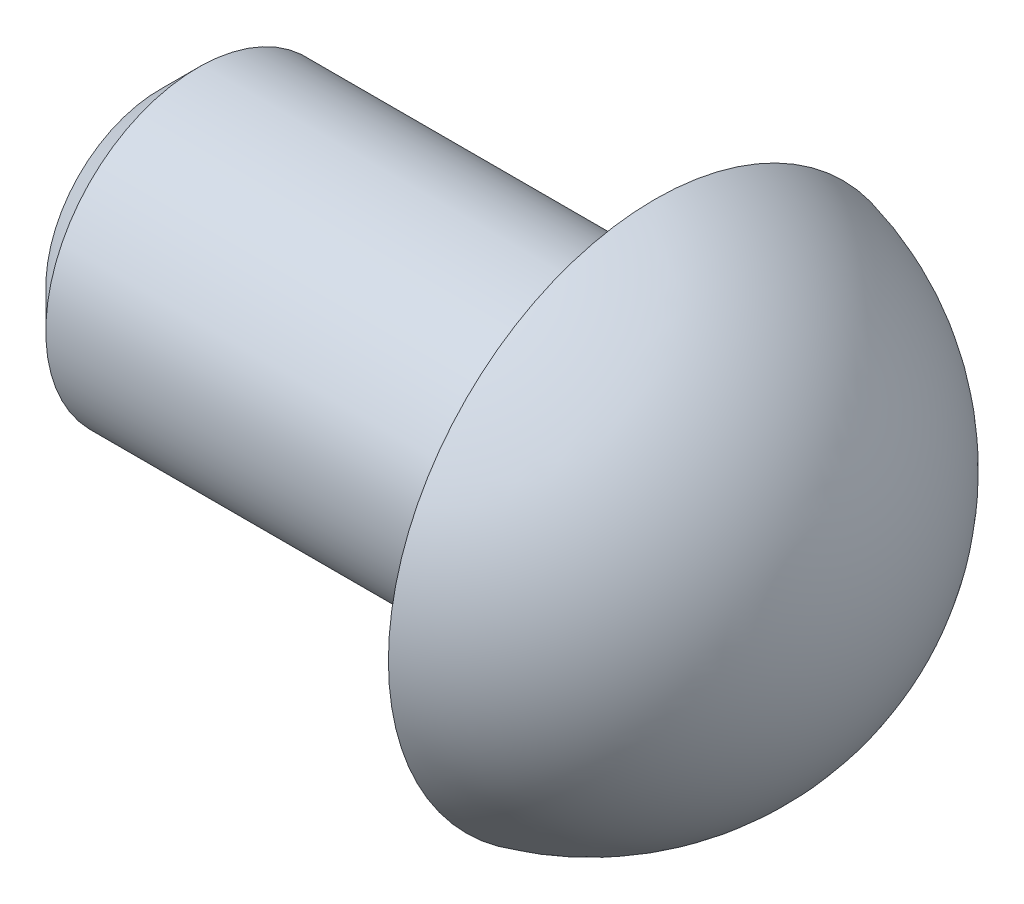
from build123d import *

# Parameters (mm, degrees)
SKETCH1_R           = 2
BOSS_EXTRUDE1_DEPTH = 6.5
CHAMFER1_SIZE       = 0.5


with BuildPart() as part:
    # Sketch1 → Boss-Extrude1 (new body)
    with BuildSketch(Plane(origin=(0, 0, 0), x_dir=(0, 0, -1), z_dir=(1, 0, 0))):
        Circle(SKETCH1_R)
    extrude(amount=-BOSS_EXTRUDE1_DEPTH)

    # Sketch3 → Revolve1 (revolve)
    with BuildSketch(Plane(origin=(0, 0, 0), x_dir=(1, 0, 0), z_dir=(0, 1, 0))):
        with BuildLine():
            Line((0, -3.5), (0, 0))
            Line((0, 0), (2.757385023, 0))
            ThreePointArc((2.757385023, 0), (1.985229955, -2.227844932), (0, -3.5))
        make_face()
    revolve(axis=Axis((-3.019086005, 0, 0), (1, 0, 0)))

    # Chamfer1
    chamfer1_edges = [part.edges().sort_by_distance(p)[0] for p in [
        (-6.5, 0, 2),
    ]]
    chamfer(chamfer1_edges, length=CHAMFER1_SIZE)


solid = part.part
